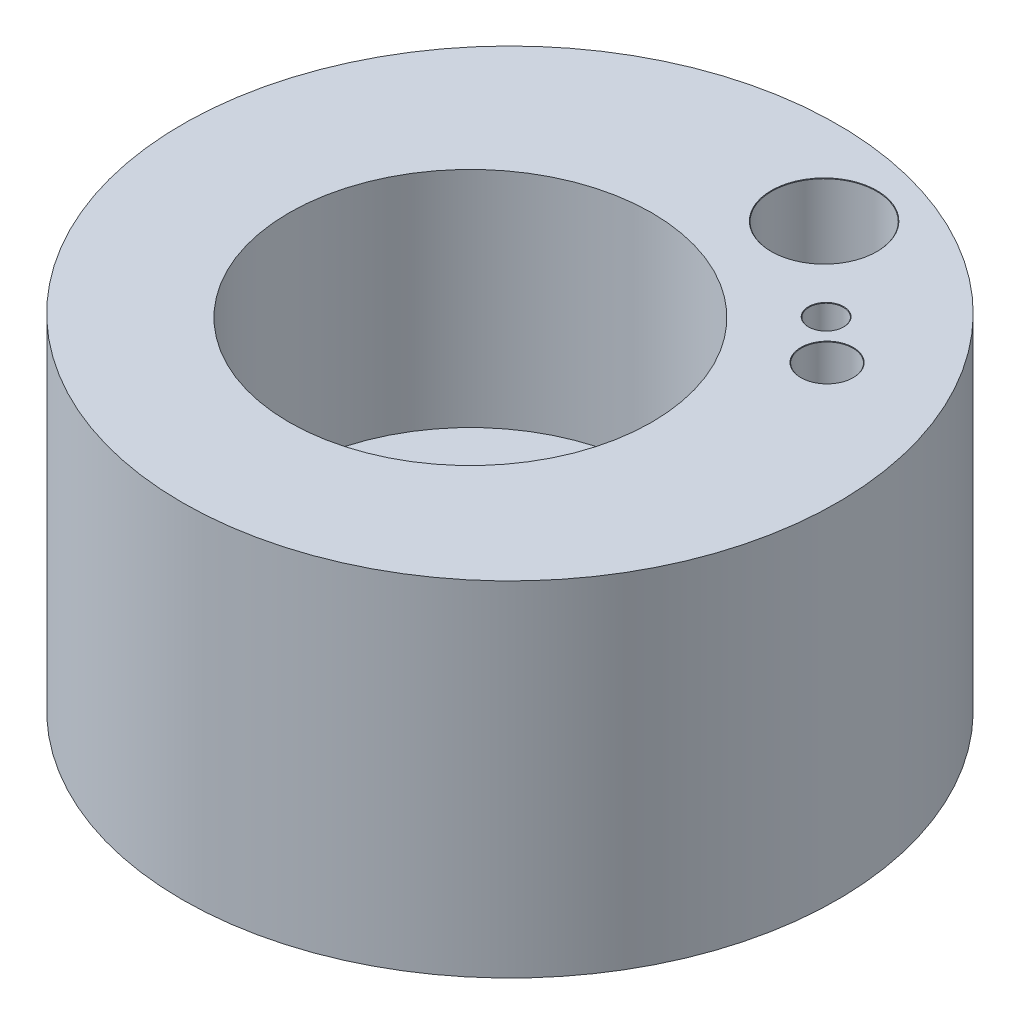
from build123d import *

# Parameters (mm, degrees)
SKETCH130_R                                        = 19.05
BOSS_EXTRUDE6_DEPTH                                = 20
HEATCARTRIDGEHOLE9_32_0_28125_DIAMETER_D           = 6.1
HEATCARTRIDGEHOLE9_32_0_28125_DIAMETER_DEPTH       = 12
HEATCARTRIDGEHOLE9_32_0_28125_DIAMETER_CSINK_D     = 6.15
HEATCARTRIDGEHOLE9_32_0_28125_DIAMETER_CSINK_ANGLE = 90
HEATCARTRIDGEHOLE9_32_0_28125_DIAMETER_TIP         = 1.832624888
F_2_0_2_DIAMETER_HOLE1_D                           = 2
F_2_0_2_DIAMETER_HOLE1_DEPTH                       = 5
F_2_0_2_DIAMETER_HOLE1_CSINK_D                     = 2.05
F_2_0_2_DIAMETER_HOLE1_CSINK_ANGLE                 = 90
F_2_0_2_DIAMETER_HOLE1_TIP                         = 0.600860619
F_3_0_3_DIAMETER_HOLE1_D                           = 3
F_3_0_3_DIAMETER_HOLE1_DEPTH                       = 5
F_3_0_3_DIAMETER_HOLE1_CSINK_D                     = 3.05
F_3_0_3_DIAMETER_HOLE1_CSINK_ANGLE                 = 90
F_3_0_3_DIAMETER_HOLE1_TIP                         = 0.901290929
F_6_0_6_DIAMETER_HOLE2_D                           = 6
F_6_0_6_DIAMETER_HOLE2_DEPTH                       = 35.197418143
F_6_0_6_DIAMETER_HOLE2_CSINK_D                     = 6.05
F_6_0_6_DIAMETER_HOLE2_CSINK_ANGLE                 = 90
F_6_0_6_DIAMETER_HOLE2_TIP                         = 1.802581857
SKETCH182_R                                        = 10.54735
CUT_EXTRUDE17_DEPTH                                = 13


with BuildPart() as part:
    # Sketch130 → Boss-Extrude6 (new body)
    with BuildSketch(Plane(origin=(0, 0, 0), x_dir=(1, 0, 0), z_dir=(0, 1, 0))):
        with Locations(Location((0, 0, 0), (0, 0, 270))):
            Circle(SKETCH130_R)
    extrude(amount=BOSS_EXTRUDE6_DEPTH)

    # HeatCartridgeHole9/32 (0.28125) Diameter Hole1
    with Locations(Plane(origin=(0, 20, 0), x_dir=(1, 0, 0), z_dir=(0, 1, 0))):
        with Locations((4.480746418, 13.790319486)):
            CounterSinkHole(HEATCARTRIDGEHOLE9_32_0_28125_DIAMETER_D / 2, HEATCARTRIDGEHOLE9_32_0_28125_DIAMETER_CSINK_D / 2, depth=HEATCARTRIDGEHOLE9_32_0_28125_DIAMETER_DEPTH, counter_sink_angle=HEATCARTRIDGEHOLE9_32_0_28125_DIAMETER_CSINK_ANGLE)
            with Locations((0, 0, -(HEATCARTRIDGEHOLE9_32_0_28125_DIAMETER_DEPTH + HEATCARTRIDGEHOLE9_32_0_28125_DIAMETER_TIP / 2))):  # 118° drill point
                Cone(0, HEATCARTRIDGEHOLE9_32_0_28125_DIAMETER_D / 2, HEATCARTRIDGEHOLE9_32_0_28125_DIAMETER_TIP, mode=Mode.SUBTRACT)

    # Ø2.0 (2) Diameter Hole1
    with Locations(Plane(origin=(0, 20, 0), x_dir=(1, 0, 0), z_dir=(0, 1, 0))):
        with Locations((9.358798046, 9.027462242)):
            CounterSinkHole(F_2_0_2_DIAMETER_HOLE1_D / 2, F_2_0_2_DIAMETER_HOLE1_CSINK_D / 2, depth=F_2_0_2_DIAMETER_HOLE1_DEPTH, counter_sink_angle=F_2_0_2_DIAMETER_HOLE1_CSINK_ANGLE)
            with Locations((0, 0, -(F_2_0_2_DIAMETER_HOLE1_DEPTH + F_2_0_2_DIAMETER_HOLE1_TIP / 2))):  # 118° drill point
                Cone(0, F_2_0_2_DIAMETER_HOLE1_D / 2, F_2_0_2_DIAMETER_HOLE1_TIP, mode=Mode.SUBTRACT)

    # Ø3.0 (3) Diameter Hole1
    with Locations(Plane(origin=(0, 20, 0), x_dir=(1, 0, 0), z_dir=(0, 1, 0))):
        with Locations((11.691342951, 6.75)):
            CounterSinkHole(F_3_0_3_DIAMETER_HOLE1_D / 2, F_3_0_3_DIAMETER_HOLE1_CSINK_D / 2, depth=F_3_0_3_DIAMETER_HOLE1_DEPTH, counter_sink_angle=F_3_0_3_DIAMETER_HOLE1_CSINK_ANGLE)
            with Locations((0, 0, -(F_3_0_3_DIAMETER_HOLE1_DEPTH + F_3_0_3_DIAMETER_HOLE1_TIP / 2))):  # 118° drill point
                Cone(0, F_3_0_3_DIAMETER_HOLE1_D / 2, F_3_0_3_DIAMETER_HOLE1_TIP, mode=Mode.SUBTRACT)

    # Ø6.0 (6) Diameter Hole2
    with Locations(Plane(origin=(0, 0, 0), x_dir=(-1, 0, 0), z_dir=(0, -1, 0))):
        with Locations((0.946159788, -1.351256215)):
            CounterSinkHole(F_6_0_6_DIAMETER_HOLE2_D / 2, F_6_0_6_DIAMETER_HOLE2_CSINK_D / 2, depth=F_6_0_6_DIAMETER_HOLE2_DEPTH, counter_sink_angle=F_6_0_6_DIAMETER_HOLE2_CSINK_ANGLE)
            with Locations((0, 0, -(F_6_0_6_DIAMETER_HOLE2_DEPTH + F_6_0_6_DIAMETER_HOLE2_TIP / 2))):  # 118° drill point
                Cone(0, F_6_0_6_DIAMETER_HOLE2_D / 2, F_6_0_6_DIAMETER_HOLE2_TIP, mode=Mode.SUBTRACT)

    # Sketch182 → Cut-Extrude17 (cut)
    with BuildSketch(Plane(origin=(0, 20, 0), x_dir=(1, 0, 0), z_dir=(0, 1, 0))):
        with Locations(Location((-0.946159788, -1.351256215, 0), (0, 0, 270))):
            Circle(SKETCH182_R)
    extrude(amount=-CUT_EXTRUDE17_DEPTH, mode=Mode.SUBTRACT)


solid = part.part
